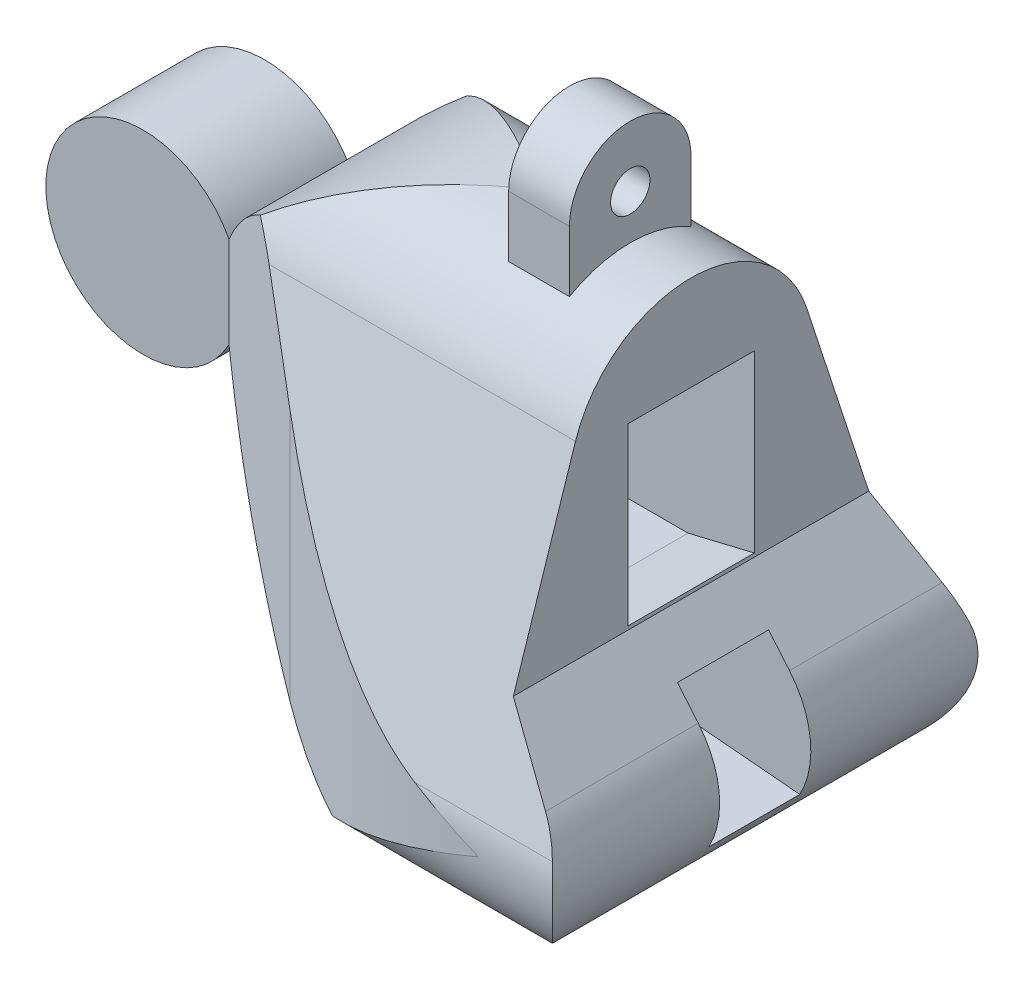
from build123d import *

# Parameters (mm, degrees)
BOSS_EXTRUDE1_DEPTH      = 6.35
BOSS_EXTRUDE2_START      = -7.9375
BOSS_EXTRUDE2_DEPTH      = 22.225
CUT_EXTRUDE1_DEPTH       = 46.365450693
CUT_EXTRUDE2_START       = -7.9375
CUT_EXTRUDE2_DEPTH       = 25.24
CUT_EXTRUDE7_DEPTH       = 10
CUT_EXTRUDE7_DEPTH_BACK  = 19.05
CUT_EXTRUDE10_DEPTH      = 10.16
CUT_EXTRUDE10_DEPTH_BACK = 17.78
CUT_EXTRUDE8_START       = 0.127
CUT_EXTRUDE8_DEPTH       = 6.604
BOSS_EXTRUDE3_START      = -3.175
BOSS_EXTRUDE3_DEPTH      = 3.175
SKETCH14_W               = 1.0287
SKETCH14_H               = 3.176
SKETCH15_W               = 4.7625
SKETCH15_H               = 4.7625
CUT_EXTRUDE15_DEPTH      = 7.048780443
CUT_EXTRUDE16_START      = -3.175
SKETCH16_W               = 4.7625
SKETCH16_H               = 4.7625
CUT_EXTRUDE16_DEPTH      = 32.52405251
SKETCH18_W               = 1.0287
SKETCH18_H               = 3.176
CUT_EXTRUDE17_DEPTH      = 4.7625


with BuildPart() as part:
    # Sketch2 → Boss-Extrude1 (new body)
    with BuildSketch(Plane.XY):
        with BuildLine():
            Line((4.487320853, -2.38125), (4.487320853, 2.38125))
            ThreePointArc((4.487320853, 2.38125), (-5.08, 0), (4.487320853, -2.38125))
        make_face()
    extrude(amount=BOSS_EXTRUDE1_DEPTH)


with BuildPart() as body_2:
    # Sketch3 → Boss-Extrude2 (new body)
    with BuildSketch(Plane.XY.offset(BOSS_EXTRUDE2_START)):
        Polygon((4.487320853, 9.525), (25.442320853, 9.525), (25.442320853, -4.7625), (34.766815504, -15.875), (25.442320853, -15.875), (4.487320853, -15.875), align=None)
    extrude(amount=BOSS_EXTRUDE2_DEPTH)

    # Sketch4 → Cut-Extrude1 (cut, through all)
    with BuildSketch(Plane(origin=(0, 9.525, 0), x_dir=(1, 0, 0), z_dir=(0, 1, 0))):
        with BuildLine():
            Line((4.487320853, -6.35), (11.994161802, -10.684076643))
            ThreePointArc((11.994161802, -10.684076643), (18.481041485, -13.371030185), (25.442320853, -14.2875))
            Line((25.442320853, -14.2875), (4.487320853, -14.2875))
            Line((4.487320853, -14.2875), (4.487320853, -6.35))
        make_face()
        with BuildLine():
            Line((4.487320853, 0), (11.994161802, 4.334076643))
            ThreePointArc((11.994161802, 4.334076643), (18.481041485, 7.021030185), (25.442320853, 7.9375))
            Line((25.442320853, 7.9375), (4.487320853, 7.9375))
            Line((4.487320853, 7.9375), (4.487320853, 0))
        make_face()
    extrude(amount=-CUT_EXTRUDE1_DEPTH, mode=Mode.SUBTRACT)

    # Sketch5 → Cut-Extrude2 (cut)
    with BuildSketch(Plane.XY.offset(CUT_EXTRUDE2_START)):
        with BuildLine():
            Line((4.487320853, -15.875), (4.487320853, -2.38125))
            Line((4.487320853, -2.38125), (4.836453379, -3.34048373))
            ThreePointArc((4.836453379, -3.34048373), (11.810966692, -12.429846444), (22.737597804, -15.875))
            Line((22.737597804, -15.875), (4.487320853, -15.875))
        make_face()
        with BuildLine():
            Line((4.487320853, 2.38125), (4.487320853, 9.525))
            Line((4.487320853, 9.525), (17.504820853, 9.525))
            ThreePointArc((17.504820853, 9.525), (10.080393765, 7.621692137), (4.487320853, 2.38125))
        make_face()
        with BuildLine():
            Line((24.553601296, -15.875), (34.766815504, -15.875))
            Line((34.766815504, -15.875), (28.201887956, -8.051224009))
            ThreePointArc((28.201887956, -8.051224009), (28.869892131, -13.125219472), (24.553601296, -15.875))
        make_face()
    extrude(amount=CUT_EXTRUDE2_DEPTH, mode=Mode.SUBTRACT)

    # Sketch7 → Cut-Extrude7 (cut, two sides: drawn at the far end of the back side and taken through both)
    with BuildSketch(Plane(origin=(25.442320853, 0, 0), x_dir=(0, 0, -1), z_dir=(1, 0, 0)).offset(-CUT_EXTRUDE7_DEPTH_BACK)):
        with BuildLine():
            ThreePointArc((-9.525, -15.875), (-12.892596049, -14.480096041), (-14.2875, -11.112499989))
            Line((-14.2875, -11.112499989), (-14.2875, -15.875))
            Line((-14.2875, -15.875), (-9.525, -15.875))
        make_face()
        with BuildLine():
            ThreePointArc((7.9375, -11.112499982), (6.542596052, -14.480096039), (3.175, -15.875))
            Line((3.175, -15.875), (7.9375, -15.875))
            Line((7.9375, -15.875), (7.9375, -11.112499982))
        make_face()
    extrude(amount=CUT_EXTRUDE7_DEPTH + CUT_EXTRUDE7_DEPTH_BACK, mode=Mode.SUBTRACT)

    # Sketch7<4> → Cut-Extrude10 (cut, two sides: drawn at the far end of the back side and taken through both)
    with BuildSketch(Plane(origin=(25.442320853, 0, 0), x_dir=(0, 0, -1), z_dir=(1, 0, 0)).offset(-CUT_EXTRUDE10_DEPTH_BACK)):
        with BuildLine():
            ThreePointArc((-9.209570672, 5.151475854), (-6.901384194, 8.316649622), (-3.175, 9.525))
            Line((-3.175, 9.525), (-14.2875, 9.525))
            Line((-14.2875, 9.525), (-14.2875, -4.7625))
            Line((-14.2875, -4.7625), (-12.456650698, -4.7625))
            Line((-12.456650698, -4.7625), (-9.209570672, 5.151475854))
        make_face()
        with BuildLine():
            Line((6.106650698, -4.7625), (7.9375, -4.7625))
            Line((7.9375, -4.7625), (7.9375, 9.525))
            Line((7.9375, 9.525), (-3.175, 9.525))
            ThreePointArc((-3.175, 9.525), (0.551384194, 8.316649622), (2.859570672, 5.151475854))
            Line((2.859570672, 5.151475854), (6.106650698, -4.7625))
        make_face()
        with BuildLine():
            ThreePointArc((7.700928004, -9.630143109), (7.877985134, -10.361942155), (7.9375, -11.112499982))
            Line((7.9375, -11.112499982), (7.9375, -4.7625))
            Line((7.9375, -4.7625), (6.106650698, -4.7625))
            Line((6.106650698, -4.7625), (7.700928004, -9.630143109))
        make_face()
        with BuildLine():
            Line((-14.050928004, -9.630143109), (-12.456650698, -4.7625))
            Line((-12.456650698, -4.7625), (-14.2875, -4.7625))
            Line((-14.2875, -4.7625), (-14.2875, -11.112499989))
            ThreePointArc((-14.2875, -11.112499989), (-14.227985135, -10.361942158), (-14.050928004, -9.630143109))
        make_face()
    extrude(amount=CUT_EXTRUDE10_DEPTH + CUT_EXTRUDE10_DEPTH_BACK, mode=Mode.SUBTRACT)

    # Sketch8 → Cut-Extrude8 (cut)
    with BuildSketch(Plane.XY.offset(6.35).offset(CUT_EXTRUDE8_START)):
        Polygon((25.442320853, -4.572), (25.442320853, 4.572), (21.984176633, 5.400477249), (15.917320853, 5.400477249), (15.917320853, -5.400477249), (21.984176633, -5.400477249), align=None)
    extrude(amount=-CUT_EXTRUDE8_DEPTH, mode=Mode.SUBTRACT)

    # Sketch12 → Boss-Extrude3 (add)
    with BuildSketch(Plane(origin=(25.442320853, 0, 0), x_dir=(0, 0, -1), z_dir=(1, 0, 0)).offset(BOSS_EXTRUDE3_START)):
        with BuildLine():
            Line((-6.35, 8.674261314), (0, 8.674261314))
            Line((0, 8.674261314), (0, 11.849261314))
            ThreePointArc((0, 11.849261314), (-3.175, 15.024261314), (-6.35, 11.849261314))
            Line((-6.35, 11.849261314), (-6.35, 8.674261314))
        make_face()
    extrude(amount=-BOSS_EXTRUDE3_DEPTH)

    # Sketch14 → #1 Clearance Hole1 (revolve, cut)
    with BuildSketch(Plane(origin=(22.267320853, 11.849261314, 3.175), x_dir=(0, 0, -1), z_dir=(0, 1, 0))):
        with Locations((0.51435, 1.588)):
            Rectangle(SKETCH14_W, SKETCH14_H)
    revolve(axis=Axis((28.617320853, 11.849261314, 3.175), (-1, 0, 0)), mode=Mode.SUBTRACT)

    # Sketch15 → Cut-Extrude15 (cut)
    with BuildSketch(Plane(origin=(29.316101296, 0, 0), x_dir=(0, 0, -1), z_dir=(1, 0, 0))):
        with Locations((-3.175, -10.432474009)):
            Rectangle(SKETCH15_W, SKETCH15_H)
    extrude(amount=-CUT_EXTRUDE15_DEPTH, mode=Mode.SUBTRACT)

    # Sketch16 → Cut-Extrude16 (cut, through all)
    with BuildSketch(Plane(origin=(22.267320853, 0, 0), x_dir=(0, 0, -1), z_dir=(1, 0, 0)).offset(CUT_EXTRUDE16_START)):
        with Locations((-3.175, -10.432474009)):
            Rectangle(SKETCH16_W, SKETCH16_H)
    extrude(amount=-CUT_EXTRUDE16_DEPTH, mode=Mode.SUBTRACT)

    # Sketch18 → #1 Clearance Hole2 (revolve, cut)
    with BuildSketch(Plane(origin=(22.267320853, -10.432474009, 3.175), x_dir=(0, 0, -1), z_dir=(0, 1, 0))):
        with Locations((0.51435, 1.588)):
            Rectangle(SKETCH18_W, SKETCH18_H)
    revolve(axis=Axis((28.617320853, -10.432474009, 3.175), (-1, 0, 0)), mode=Mode.SUBTRACT)

    # Sketch19 → Cut-Extrude17 (cut)
    with BuildSketch(Plane.XY.offset(0.79375)):
        with BuildLine():
            Line((19.092320853, -12.813724009), (14.556839931, -14.029002459))
            ThreePointArc((14.556839931, -14.029002459), (10.078161119, -11.060208562), (6.606659352, -6.958870171))
            Line((6.606659352, -6.958870171), (19.092320853, -8.051224009))
            Line((19.092320853, -8.051224009), (19.092320853, -12.813724009))
        make_face()
        with BuildLine():
            Line((22.267320853, -8.051224009), (27.112513818, -6.752958467))
            Line((27.112513818, -6.752958467), (28.201887956, -8.051224009))
            ThreePointArc((28.201887956, -8.051224009), (29.291863406, -10.632626656), (28.741581352, -13.380148407))
            Line((28.741581352, -13.380148407), (22.267320853, -12.813724009))
            Line((22.267320853, -12.813724009), (22.267320853, -8.051224009))
        make_face()
    extrude(amount=CUT_EXTRUDE17_DEPTH, mode=Mode.SUBTRACT)


solid = Compound([part.part, body_2.part])
